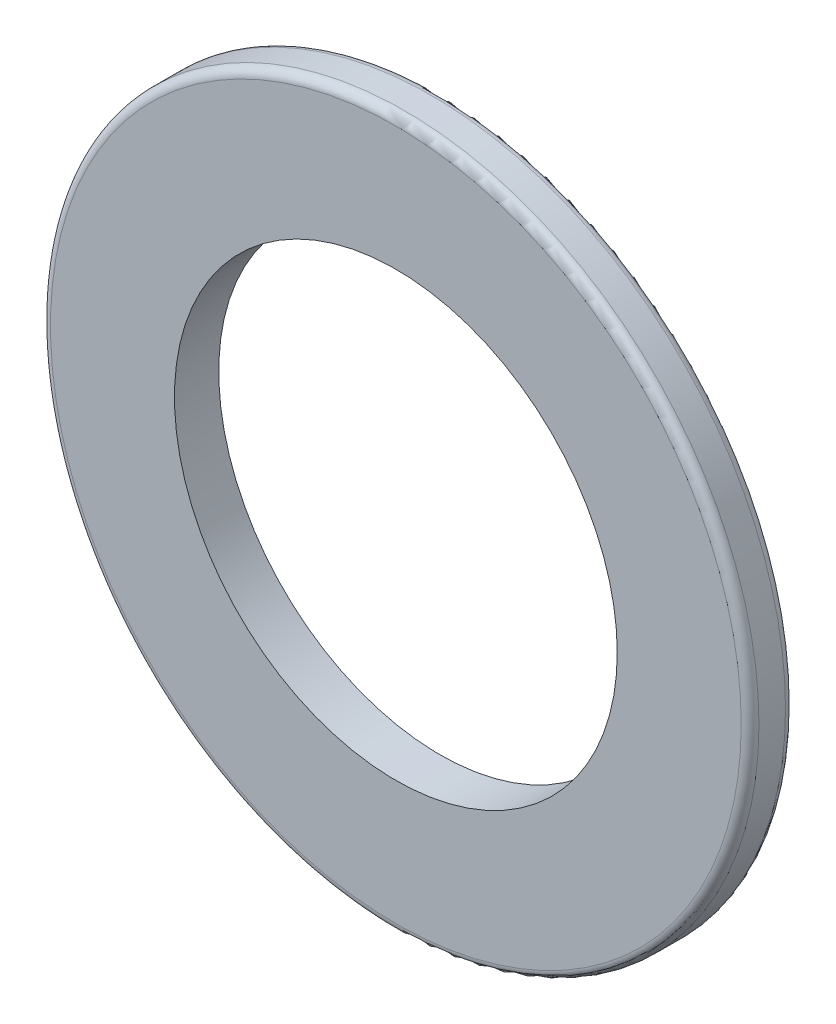
from build123d import *

# Parameters (mm, degrees)
SKETCH_1_R      = 4
SKETCH_1_R_2    = 2.5
EXTRUDE_1_DEPTH = 0.5
FILLET_1_R      = 0.1


with BuildPart() as part:
    # 草图1 → 凸台-拉伸1 (new body)
    with BuildSketch(Plane.XY):
        Circle(SKETCH_1_R)
        Circle(SKETCH_1_R_2, mode=Mode.SUBTRACT)
    extrude(amount=EXTRUDE_1_DEPTH)

    # 圆角1
    fillet_1_edges = [part.edges().sort_by_distance(p)[0] for p in [
        (-4, 0, 0),
        (-4, 0, 0.5),
    ]]
    fillet(fillet_1_edges, radius=FILLET_1_R)


solid = part.part
